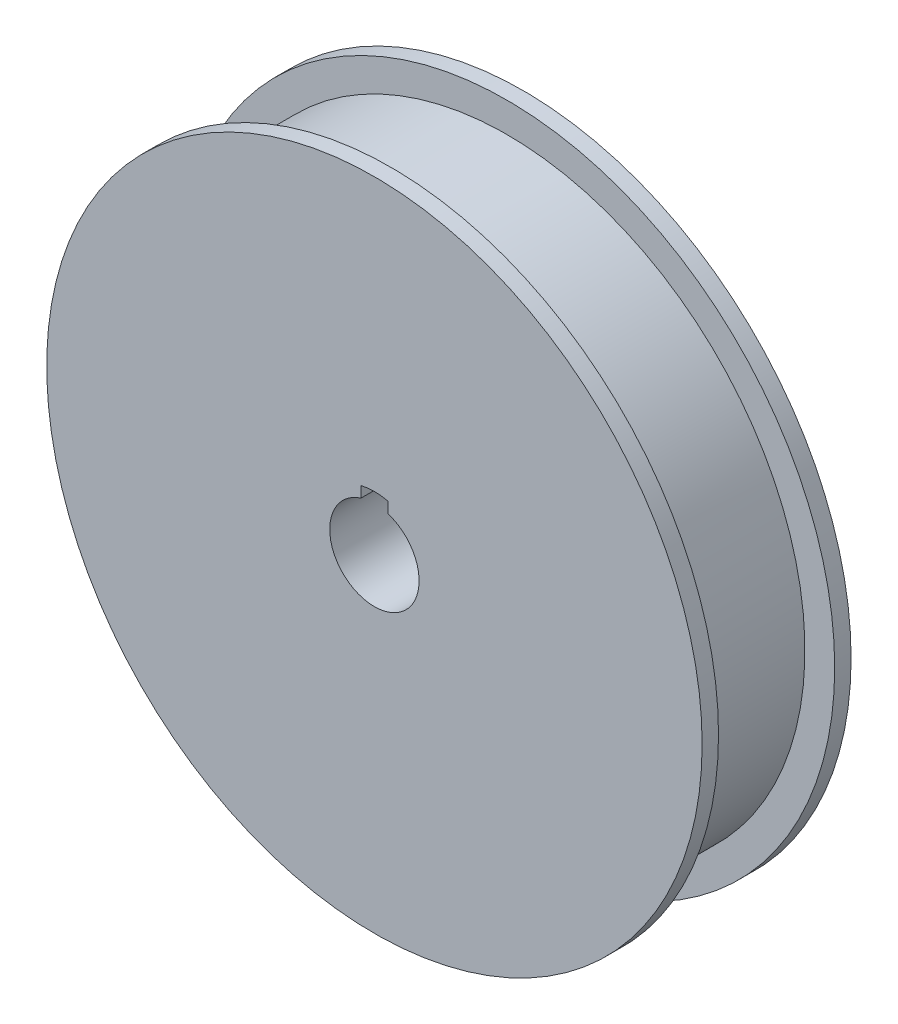
from build123d import *

# Parameters (mm, degrees)
SKETCH1_R           = 200
SKETCH1_R_2         = 30
BOSS_EXTRUDE1_DEPTH = 50
BOSS_EXTRUDE2_START = -11
SKETCH2_R           = 220
SKETCH2_R_2         = 30
BOSS_EXTRUDE2_DEPTH = 11
CUT_EXTRUDE1_DEPTH  = 327.802692767


with BuildPart() as part:
    # Sketch1 → Boss-Extrude1 (new, symmetric)
    with BuildSketch(Plane.XY):
        Circle(SKETCH1_R)
        Circle(SKETCH1_R_2, mode=Mode.SUBTRACT)
    extrude(amount=BOSS_EXTRUDE1_DEPTH, both=True)

    # Sketch2 → Boss-Extrude2 (add)
    with BuildSketch(Plane.XY.offset(50).offset(BOSS_EXTRUDE2_START)):
        Circle(SKETCH2_R)
        Circle(SKETCH2_R_2, mode=Mode.SUBTRACT)
    boss_extrude2 = extrude(amount=BOSS_EXTRUDE2_DEPTH)

    # Mirror1: Boss-Extrude2 across plane
    add(boss_extrude2.mirror(Plane.XY))

    # Sketch3 → Cut-Extrude1 (cut, through all)
    with BuildSketch(Plane.XY.offset(50)):
        with BuildLine():
            Line((9, 19.456611091), (9, 35.88871689))
            ThreePointArc((9, 35.88871689), (0, 37), (-9, 35.88871689))
            Line((-9, 35.88871689), (-9, 19.456611091))
            Line((-9, 19.456611091), (9, 19.456611091))
        make_face()
    extrude(amount=-CUT_EXTRUDE1_DEPTH, mode=Mode.SUBTRACT)


solid = part.part
